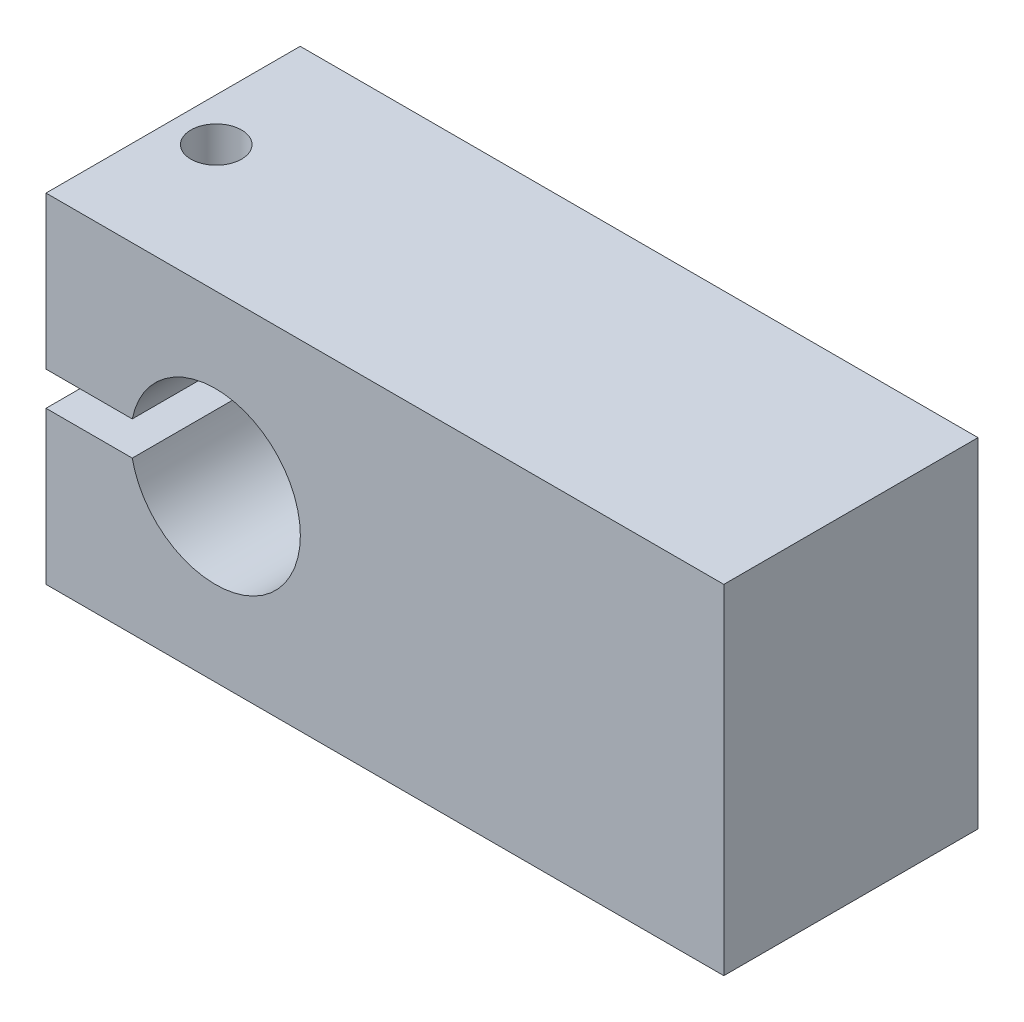
from build123d import *

# Parameters (mm, degrees)
SKETCH1_W                 = 50.8
SKETCH1_H                 = 25.4
BOSS_EXTRUDE1_DEPTH       = 19.05
CUT_EXTRUDE1_DEPTH        = 19.05
F_6_CLEARANCE_HOLE1_D     = 3.7973
F_6_CLEARANCE_HOLE1_DEPTH = 11.43
F_6_32_TAPPED_HOLE1_D     = 2.7051


with BuildPart() as part:
    # Sketch1 → Boss-Extrude1 (new body)
    with BuildSketch(Plane.XY):
        with Locations((25.4, 12.7)):
            Rectangle(SKETCH1_W, SKETCH1_H)
    extrude(amount=BOSS_EXTRUDE1_DEPTH)

    # Sketch2 → Cut-Extrude1 (cut)
    with BuildSketch(Plane.XY.offset(19.05)):
        with BuildLine():
            Line((12.7, 13.97), (12.7, 11.43))
            Line((12.7, 11.43), (6.465334709, 11.43))
            ThreePointArc((6.465334709, 11.43), (13.338218788, 6.369389597), (19.0627, 12.7))
            ThreePointArc((19.0627, 12.7), (13.338218788, 19.030610403), (6.465334709, 13.97))
            Line((6.465334709, 13.97), (12.7, 13.97))
        make_face()
        with BuildLine():
            Line((6.465334709, 11.43), (12.7, 11.43))
            Line((12.7, 11.43), (12.7, 13.97))
            Line((12.7, 13.97), (6.465334709, 13.97))
            ThreePointArc((6.465334709, 13.97), (6.3373, 12.7), (6.465334709, 11.43))
        make_face()
        with BuildLine():
            Line((0, 11.43), (6.465334709, 11.43))
            ThreePointArc((6.465334709, 11.43), (6.3373, 12.7), (6.465334709, 13.97))
            Line((6.465334709, 13.97), (0, 13.97))
            Line((0, 13.97), (0, 11.43))
        make_face()
    extrude(amount=-CUT_EXTRUDE1_DEPTH, mode=Mode.SUBTRACT)

    # #6 Clearance Hole1
    with Locations(Plane(origin=(0, 25.4, 0), x_dir=(1, 0, 0), z_dir=(0, 1, 0))):
        with Locations((3.232667355, -9.525)):
            Hole(F_6_CLEARANCE_HOLE1_D / 2, depth=F_6_CLEARANCE_HOLE1_DEPTH)

    # #6-32 Tapped Hole1 (through all)
    with Locations(Plane(origin=(0, 11.43, 0), x_dir=(1, 0, 0), z_dir=(0, 1, 0))):
        with Locations((3.232667355, -9.525)):
            Hole(F_6_32_TAPPED_HOLE1_D / 2)


solid = part.part
